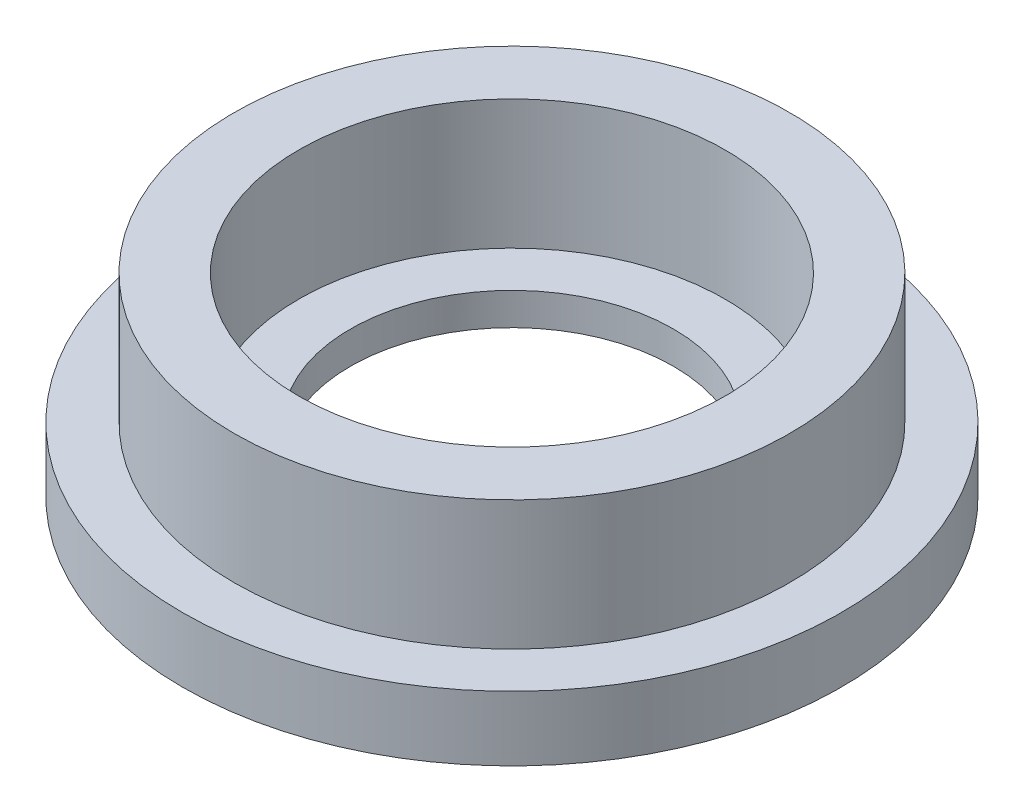
from build123d import *

# Parameters (mm, degrees)
SKETCH1_R           = 5.1
BOSS_EXTRUDE1_DEPTH = 1
SKETCH2_R           = 4.3
SKETCH2_R_2         = 3.3
BOSS_EXTRUDE2_DEPTH = 2
SKETCH3_R           = 2.5
CUT_EXTRUDE1_DEPTH  = 2
SKETCH4_R           = 4.5
CUT_EXTRUDE2_DEPTH  = 0.5


with BuildPart() as part:
    # Sketch1 → Boss-Extrude1 (new body)
    with BuildSketch(Plane(origin=(0, 0, 0), x_dir=(1, 0, 0), z_dir=(0, 1, 0))):
        with Locations(Location((0, 0, 0), (0, 0, 270))):
            Circle(SKETCH1_R)
    extrude(amount=BOSS_EXTRUDE1_DEPTH)

    # Sketch2 → Boss-Extrude2 (add)
    with BuildSketch(Plane(origin=(0, 1, 0), x_dir=(1, 0, 0), z_dir=(0, 1, 0))):
        with Locations(Location((0, 0, 0), (0, 0, 270))):
            Circle(SKETCH2_R)
        with Locations(Location((0, 0, 0), (0, 0, 270))):
            Circle(SKETCH2_R_2, mode=Mode.SUBTRACT)
    extrude(amount=BOSS_EXTRUDE2_DEPTH)

    # Sketch3 → Cut-Extrude1 (cut)
    with BuildSketch(Plane.XZ):
        with Locations(Location((0, 0, 0), (0, 0, 270))):
            Circle(SKETCH3_R)
    extrude(amount=-CUT_EXTRUDE1_DEPTH, mode=Mode.SUBTRACT)

    # Sketch4 → Cut-Extrude2 (cut)
    with BuildSketch(Plane.XZ):
        with Locations(Location((0, 0, 0), (0, 0, 270))):
            Circle(SKETCH4_R)
    extrude(amount=-CUT_EXTRUDE2_DEPTH, mode=Mode.SUBTRACT)


solid = part.part
